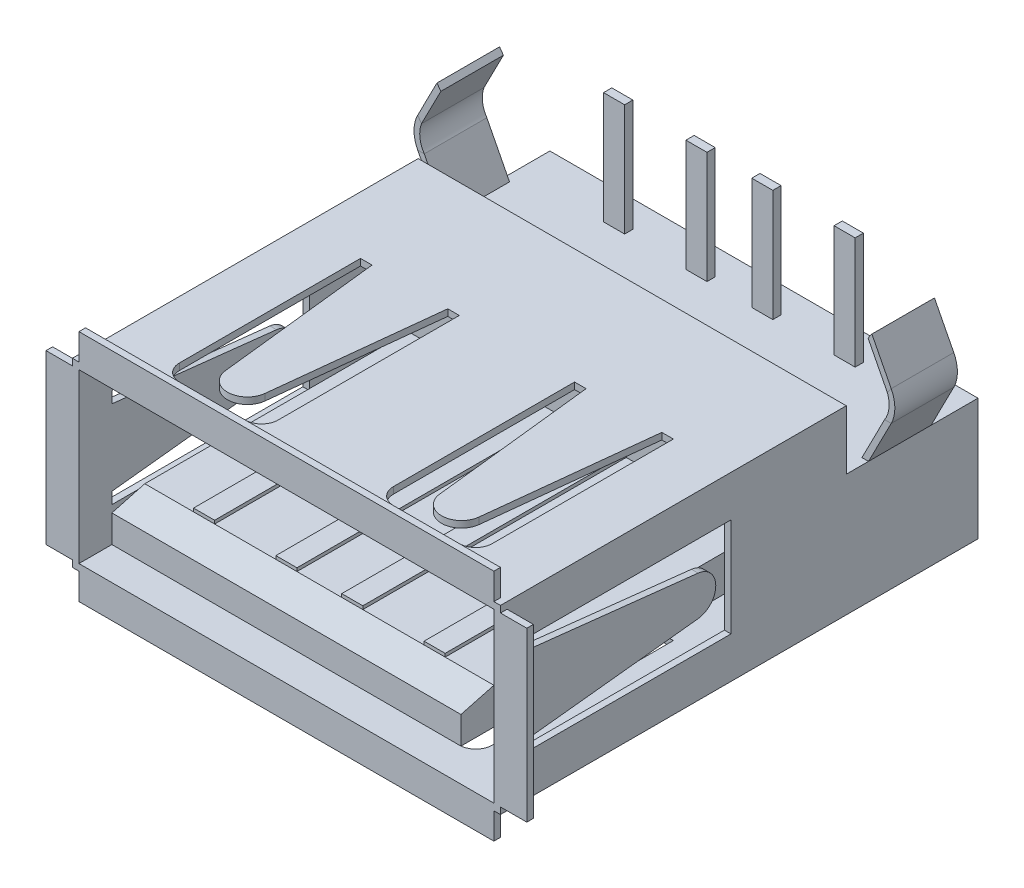
from build123d import *

# Parameters (mm, degrees)
SKETCH_1_W           = 13
SKETCH_1_H           = 5.5
EXTRUDE_1_DEPTH      = 14.5
SKETCH_2_W           = 12.6
SKETCH_2_H           = 5.1
CUT_EXTRUDE_1_DEPTH  = 9
CUT_EXTRUDE_3_DEPTH  = 17.815171721
CUT_EXTRUDE_4_DEPTH  = 20.667549415
SKETCH_5_W           = 10.6
SKETCH_5_H           = 1.1
EXTRUDE_3_DEPTH      = 9
CHAMFER_1_SIZE       = 1
CHAMFER_1_SIZE2      = 0.267949192
SKETCH_3_W           = 13
SKETCH_3_H           = 4
CUT_EXTRUDE_2_DEPTH  = 1.8
SKETCH_9_W           = 0.64
SKETCH_9_H           = 0.25
EXTRUDE_5_DEPTH      = 3.4
SKETCH_14_W          = 0.64
SKETCH_14_H          = 8.130016943
EXTRUDE_6_DEPTH      = 0.1
SKETCH_15_W          = 0.2
SKETCH_15_H          = 1.9
SKETCH_17_W          = 12.6
SKETCH_17_H          = 0.8
SKETCH_17_W_2        = 0.8
SKETCH_17_H_2        = 5.1
EXTRUDE_14_7_1_DEPTH = 0.2


with BuildPart() as part:
    # 草图1 → 凸台-拉伸1 (new body)
    with BuildSketch(Plane.XY):
        Rectangle(SKETCH_1_W, SKETCH_1_H)
    extrude(amount=EXTRUDE_1_DEPTH)

    # 草图2 → 切除-拉伸1 (cut)
    with BuildSketch(Plane.XY.offset(14.5)):
        Rectangle(SKETCH_2_W, SKETCH_2_H)
    extrude(amount=-CUT_EXTRUDE_1_DEPTH, mode=Mode.SUBTRACT)

    # 草图11 → 切除-拉伸3 (cut, through all)
    with BuildSketch(Plane.XZ.offset(2.75)):
        with BuildLine():
            Line((4.75, 7.5), (4.75, 13))
            ThreePointArc((4.75, 13), (4.603553391, 13.353553391), (4.25, 13.5))
            Line((4.25, 13.5), (2.25, 13.5))
            ThreePointArc((2.25, 13.5), (1.896446609, 13.353553391), (1.75, 13))
            Line((1.75, 13), (1.75, 7.5))
            Line((1.75, 7.5), (2.1, 7.5))
            Line((2.1, 7.5), (2.65, 12.5))
            ThreePointArc((2.65, 12.5), (3.25, 13.037619085), (3.85, 12.5))
            Line((3.85, 12.5), (4.4, 7.5))
            Line((4.4, 7.5), (4.75, 7.5))
        make_face()
        with BuildLine():
            Line((-3.85, 12.5), (-4.4, 7.5))
            Line((-4.4, 7.5), (-4.75, 7.5))
            Line((-4.75, 7.5), (-4.75, 13))
            ThreePointArc((-4.75, 13), (-4.603553391, 13.353553391), (-4.25, 13.5))
            Line((-4.25, 13.5), (-2.25, 13.5))
            ThreePointArc((-2.25, 13.5), (-1.896446609, 13.353553391), (-1.75, 13))
            Line((-1.75, 13), (-1.75, 7.5))
            Line((-1.75, 7.5), (-2.1, 7.5))
            Line((-2.1, 7.5), (-2.65, 12.5))
            ThreePointArc((-2.65, 12.5), (-3.25, 13.037619085), (-3.85, 12.5))
        make_face()
    extrude(amount=-CUT_EXTRUDE_3_DEPTH, mode=Mode.SUBTRACT)

    # 草图12 → 切除-拉伸4 (cut, through all)
    with BuildSketch(Plane(origin=(6.5, 0, 0), x_dir=(0, 0, -1), z_dir=(1, 0, 0))):
        with BuildLine():
            Line((-13.5, -1.5), (-7.5, -1.5))
            Line((-7.5, -1.5), (-7.5, 1.5))
            Line((-7.5, 1.5), (-13.5, 1.5))
            Line((-13.5, 1.5), (-13.5, 1.15))
            Line((-13.5, 1.15), (-8.5, 0.6))
            ThreePointArc((-8.5, 0.6), (-7.962380915, 0), (-8.5, -0.6))
            Line((-8.5, -0.6), (-13.5, -1.15))
            Line((-13.5, -1.15), (-13.5, -1.5))
        make_face()
    extrude(amount=-CUT_EXTRUDE_4_DEPTH, mode=Mode.SUBTRACT)

    # 草图5 → 凸台-拉伸3 (add)
    with BuildSketch(Plane.XY.offset(5.5)):
        with Locations((0, -1)):
            Rectangle(SKETCH_5_W, SKETCH_5_H)
    extrude(amount=EXTRUDE_3_DEPTH)

    # 倒角1
    chamfer_1_edges = [part.edges().sort_by_distance(p)[0] for p in [
        (0, -0.45, 14.5),
    ]]
    chamfer_1_side = [part.faces().sort_by_distance(p)[0] for p in [
        (0, -0.45, 10),
    ]]
    chamfer(chamfer_1_edges, length=CHAMFER_1_SIZE, length2=CHAMFER_1_SIZE2, reference=chamfer_1_side[0])

    # 草图3 → 切除-拉伸2 (cut)
    with BuildSketch(Plane(origin=(0, 2.75, 0), x_dir=(1, 0, 0), z_dir=(0, 1, 0))):
        with Locations((0, -2)):
            Rectangle(SKETCH_3_W, SKETCH_3_H)
    extrude(amount=-CUT_EXTRUDE_2_DEPTH, mode=Mode.SUBTRACT)

    # 草图9 → 凸台-拉伸5 (add)
    with BuildSketch(Plane(origin=(0, 0.95, 2.45), x_dir=(-1, 0, 0), z_dir=(0, -1, 0))):
        with Locations((-3.5, 1.525)):
            Rectangle(SKETCH_9_W, SKETCH_9_H)
        with Locations((1, 1.525)):
            Rectangle(SKETCH_9_W, SKETCH_9_H)
        with Locations((-1, 1.525)):
            Rectangle(SKETCH_9_W, SKETCH_9_H)
        with Locations((3.5, 1.525)):
            Rectangle(SKETCH_9_W, SKETCH_9_H)
    extrude(amount=-EXTRUDE_5_DEPTH)

    # 草图14 → 凸台-拉伸6 (add)
    with BuildSketch(Plane(origin=(0, -0.45, 0), x_dir=(1, 0, 0), z_dir=(0, 1, 0))):
        with Locations((-3.5, -9.434991528)):
            Rectangle(SKETCH_14_W, SKETCH_14_H)
        with Locations((-1, -9.434991528)):
            Rectangle(SKETCH_14_W, SKETCH_14_H)
        with Locations((1, -9.434991528)):
            Rectangle(SKETCH_14_W, SKETCH_14_H)
        with Locations((3.5, -9.434991528)):
            Rectangle(SKETCH_14_W, SKETCH_14_H)
    extrude(amount=EXTRUDE_6_DEPTH)

    # 扫描1: sweep along a path in 草图16
    with BuildLine(Plane(origin=(0, 0, 0), x_dir=(-1, 0, 0), z_dir=(0, 0, -1))) as sweep_1_path:
        Line((6.5, 0.95), (7.189615975, 2.293290664))
        ThreePointArc((7.189615975, 2.293290664), (7.3, 2.75), (7.189615975, 3.206709336))
        Line((7.189615975, 3.206709336), (6.602675615, 4.35))
    # 草图15 → 扫描1 (sweep)
    with BuildSketch(Plane(origin=(0, 0.95, 0), x_dir=(1, 0, 0), z_dir=(0, 1, 0))):
        with Locations((-6.4, -2.375)):
            Rectangle(SKETCH_15_W, SKETCH_15_H)
    sweep_1 = sweep(path=sweep_1_path.line)

    # 镜向1: 扫描1 across plane
    add(sweep_1.mirror(Plane(origin=(0, 0, 0), x_dir=(0, 0, 1), z_dir=(1, 0, 0))))

    # 草图17 → 卷边-外径14*7.1 (add)
    with BuildSketch(Plane.XY.offset(14.5)):
        with Locations((0, -3.15)):
            Rectangle(SKETCH_17_W, SKETCH_17_H)
        with Locations((6.9, 0)):
            Rectangle(SKETCH_17_W_2, SKETCH_17_H_2)
        with Locations((-6.9, 0)):
            Rectangle(SKETCH_17_W_2, SKETCH_17_H_2)
        with Locations((0, 3.15)):
            Rectangle(SKETCH_17_W, SKETCH_17_H)
    extrude(amount=-EXTRUDE_14_7_1_DEPTH)


solid = part.part
